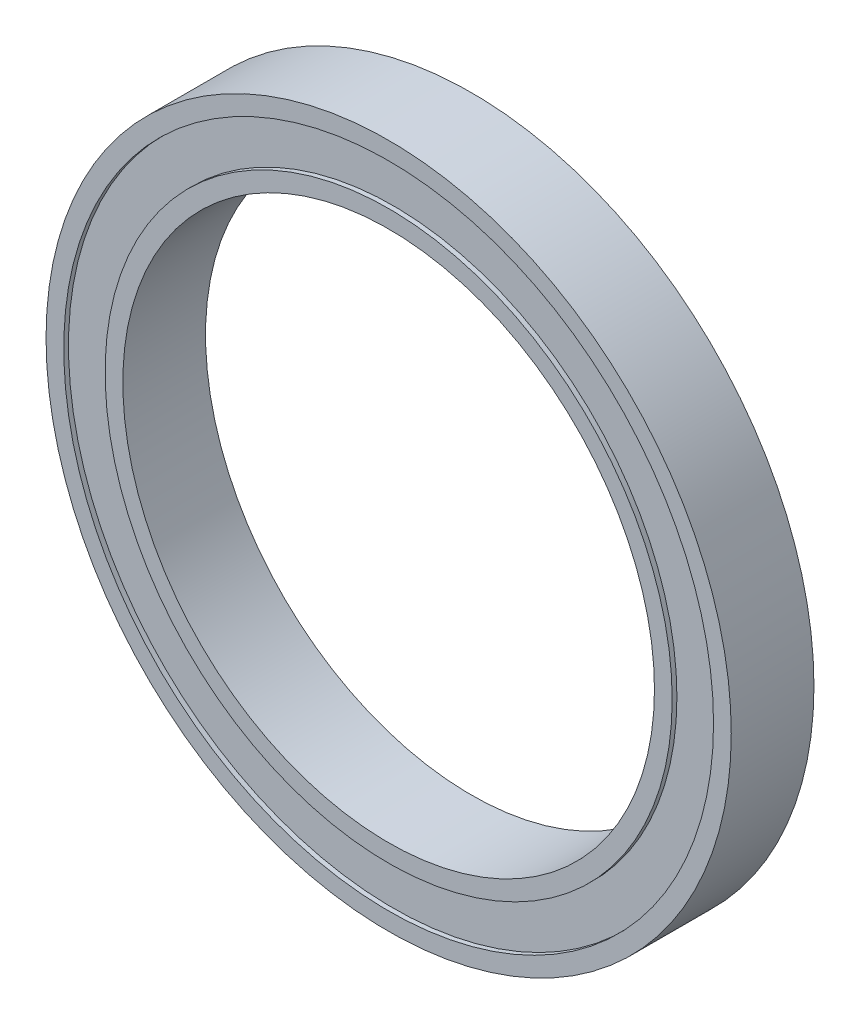
from build123d import *

# Parameters (mm, degrees)
SKETCH_1_R          = 29
SKETCH_1_R_2        = 22.5
EXTRUDE_1_DEPTH     = 7
SKETCH_2_R          = 27.5
SKETCH_2_R_2        = 24
CUT_EXTRUDE_1_DEPTH = 0.4
CUT_EXTRUDE_START   = -0.4
SKETCH_3_R          = 27.5
SKETCH_3_R_2        = 24
CUT_EXTRUDE_2_DEPTH = 0.4


with BuildPart() as part:
    # 草图1 → 凸台-拉伸1 (new body)
    with BuildSketch(Plane.XY):
        Circle(SKETCH_1_R)
        Circle(SKETCH_1_R_2, mode=Mode.SUBTRACT)
    extrude(amount=EXTRUDE_1_DEPTH)

    # 草图2 → 切除-拉伸1 (cut)
    with BuildSketch(Plane.XY.offset(7)):
        Circle(SKETCH_2_R)
        Circle(SKETCH_2_R_2, mode=Mode.SUBTRACT)
    extrude(amount=-CUT_EXTRUDE_1_DEPTH, mode=Mode.SUBTRACT)

    # 草图3 → 切除-拉伸2 (cut)
    with BuildSketch(Plane(origin=(0, 0, 0), x_dir=(-1, 0, 0), z_dir=(0, 0, -1)).offset(CUT_EXTRUDE_START)):
        with Locations(Location((0, 0, 0), (0, 0, 180))):
            Circle(SKETCH_3_R)
        with Locations(Location((0, 0, 0), (0, 0, 180))):
            Circle(SKETCH_3_R_2, mode=Mode.SUBTRACT)
    extrude(amount=CUT_EXTRUDE_2_DEPTH, mode=Mode.SUBTRACT)


solid = part.part
